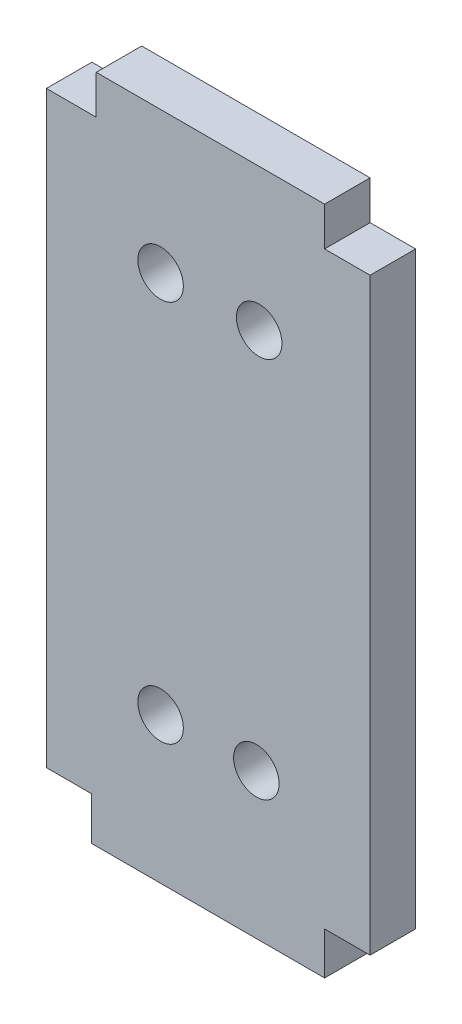
from build123d import *

# Parameters (mm, degrees)
SKETCH1_R           = 2.54
BOSS_EXTRUDE1_DEPTH = 5.08


with BuildPart() as part:
    # Sketch1 → Boss-Extrude1 (new body)
    with BuildSketch(Plane.XY):
        Polygon((-20.706897394, 61.943673476), (-20.706897394, 127.673122898), (-25.786897394, 127.673122898), (-25.786897394, 132.003591662), (-51.279097199, 132.003591662), (-51.279097199, 127.662023864), (-56.840337613, 127.662023864), (-56.840337613, 62.002568885), (-51.831563902, 62.002568885), (-51.831563902, 57.198637569), (-25.786897394, 57.198637569), (-25.786897394, 61.943673476), align=None)
        with Locations((-44.093221019, 73.47108695)):
            Circle(SKETCH1_R, mode=Mode.SUBTRACT)
        with Locations((-33.405206995, 73.431619163)):
            Circle(SKETCH1_R, mode=Mode.SUBTRACT)
        with Locations((-44.093221019, 116.1935058)):
            Circle(SKETCH1_R, mode=Mode.SUBTRACT)
        with Locations((-33.089687892, 116.152872892)):
            Circle(SKETCH1_R, mode=Mode.SUBTRACT)
    extrude(amount=BOSS_EXTRUDE1_DEPTH)


solid = part.part
